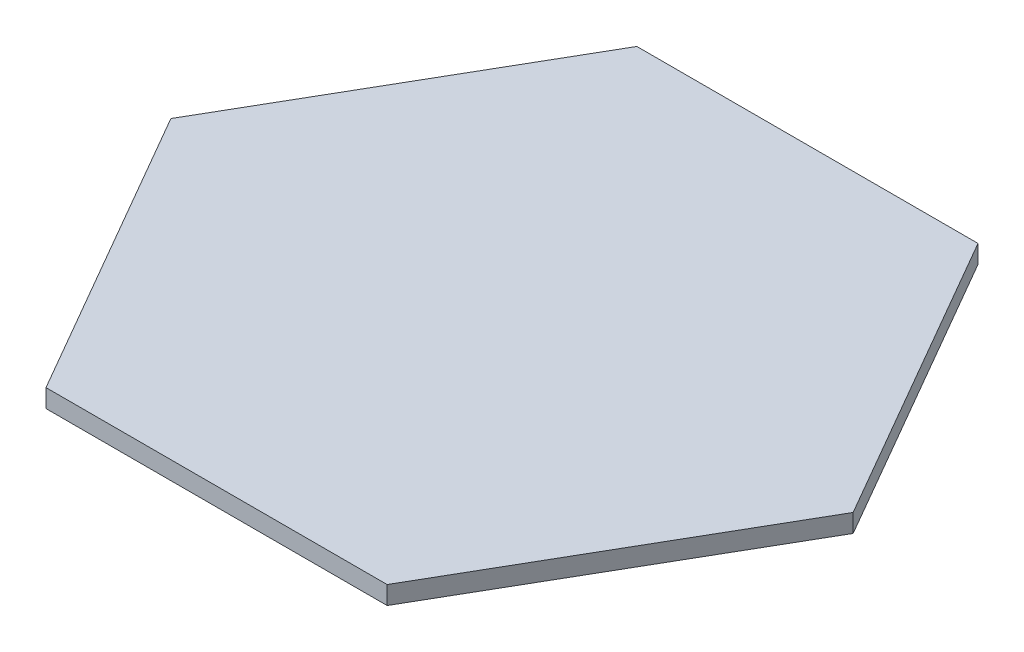
from build123d import *

# Parameters (mm, degrees)
BOSS_EXTRUDE1_DEPTH = 5.08


with BuildPart() as part:
    # Sketch4 → Boss-Extrude1 (new body)
    with BuildSketch(Plane(origin=(0, 0, 0), x_dir=(1, 0, 0), z_dir=(0, 1, 0))):
        Polygon((-47.625, -82.48891971), (47.625, -82.48891971), (95.25, 0), (47.625, 82.48891971), (-47.625, 82.48891971), (-95.25, 0), align=None)
    extrude(amount=BOSS_EXTRUDE1_DEPTH)


solid = part.part
